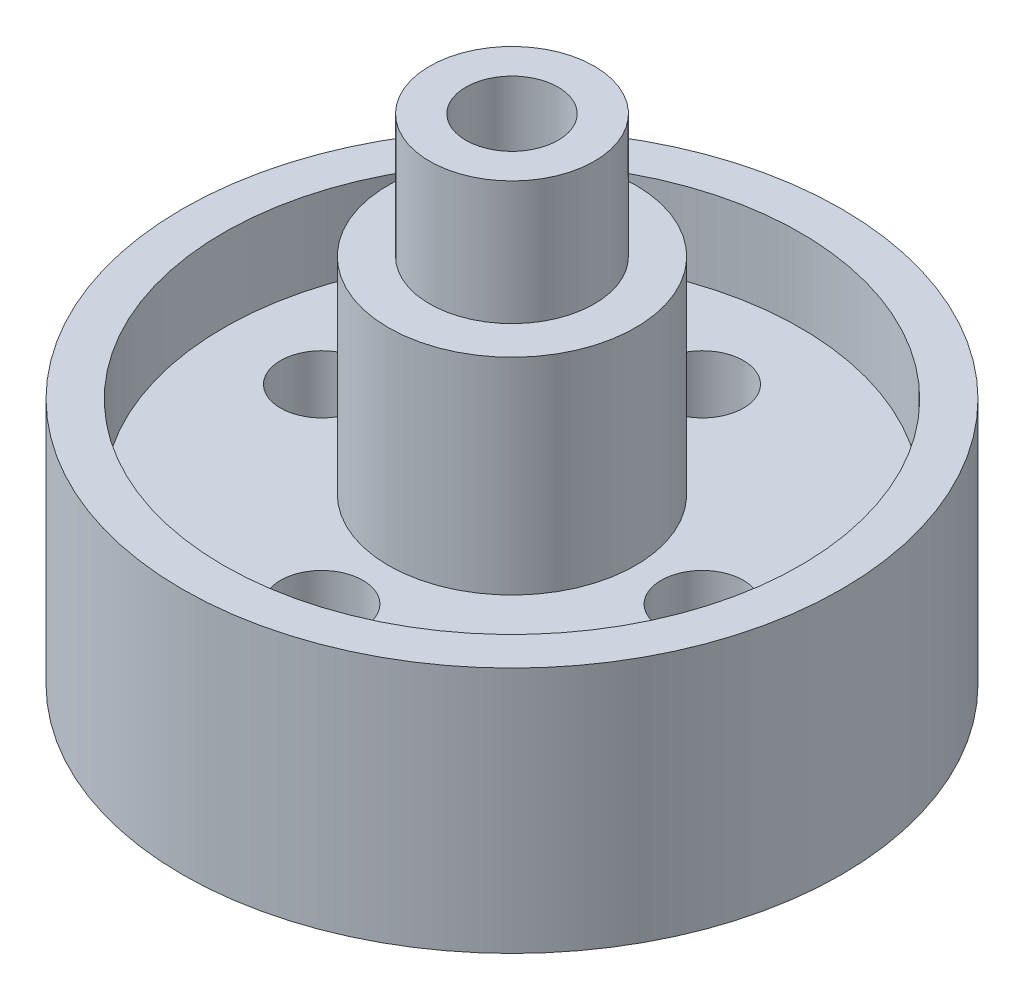
from build123d import *

# Parameters (mm, degrees)
SKETCH1_R           = 50.8
BOSS_EXTRUDE1_DEPTH = 25.4
SKETCH2_R           = 50.8
SKETCH2_R_2         = 44.45
BOSS_EXTRUDE2_DEPTH = 12.7
SKETCH3_R           = 19.05
BOSS_EXTRUDE3_DEPTH = 31.75
SKETCH4_R           = 12.7
BOSS_EXTRUDE4_DEPTH = 19.05
SKETCH5_R           = 7.112
CUT_EXTRUDE1_DEPTH  = 105.726882891
SKETCH6_R           = 6.35
CUT_EXTRUDE2_DEPTH  = 88.988181024


with BuildPart() as part:
    # Sketch1 → Boss-Extrude1 (new body)
    with BuildSketch(Plane(origin=(0, 0, 0), x_dir=(1, 0, 0), z_dir=(0, 1, 0))):
        with Locations(Location((0, 0, 0), (0, 0, 270))):
            Circle(SKETCH1_R)
    extrude(amount=BOSS_EXTRUDE1_DEPTH)

    # Sketch2 → Boss-Extrude2 (add)
    with BuildSketch(Plane(origin=(0, 25.4, 0), x_dir=(1, 0, 0), z_dir=(0, 1, 0))):
        with Locations(Location((0, 0, 0), (0, 0, 270))):
            Circle(SKETCH2_R)
        with Locations(Location((0, 0, 0), (0, 0, 270))):
            Circle(SKETCH2_R_2, mode=Mode.SUBTRACT)
    extrude(amount=BOSS_EXTRUDE2_DEPTH)

    # Sketch3 → Boss-Extrude3 (add)
    with BuildSketch(Plane(origin=(0, 25.4, 0), x_dir=(1, 0, 0), z_dir=(0, 1, 0))):
        with Locations(Location((0, 0, 0), (0, 0, 270))):
            Circle(SKETCH3_R)
    extrude(amount=BOSS_EXTRUDE3_DEPTH)

    # Sketch4 → Boss-Extrude4 (add)
    with BuildSketch(Plane(origin=(0, 57.15, 0), x_dir=(1, 0, 0), z_dir=(0, 1, 0))):
        with Locations(Location((0, 0, 0), (0, 0, 90))):
            Circle(SKETCH4_R)
    extrude(amount=BOSS_EXTRUDE4_DEPTH)

    # Sketch5 → Cut-Extrude1 (cut, through all)
    with BuildSketch(Plane(origin=(0, 76.2, 0), x_dir=(1, 0, 0), z_dir=(0, 1, 0))):
        with Locations(Location((0, 0, 0), (0, 0, 270))):
            Circle(SKETCH5_R)
    extrude(amount=-CUT_EXTRUDE1_DEPTH, mode=Mode.SUBTRACT)

    # Sketch6 → Cut-Extrude2 (cut, through all)
    with BuildSketch(Plane(origin=(0, 25.4, 0), x_dir=(1, 0, 0), z_dir=(0, 1, 0))):
        with Locations(Location((-29.337, 0, 0), (0, 0, 270))):
            Circle(SKETCH6_R)
        with Locations(Location((0, 29.337, 0), (0, 0, 270))):
            Circle(SKETCH6_R)
        with Locations(Location((29.337, 0, 0), (0, 0, 270))):
            Circle(SKETCH6_R)
        with Locations(Location((0, -29.337, 0), (0, 0, 270))):
            Circle(SKETCH6_R)
    extrude(amount=-CUT_EXTRUDE2_DEPTH, mode=Mode.SUBTRACT)


solid = part.part
